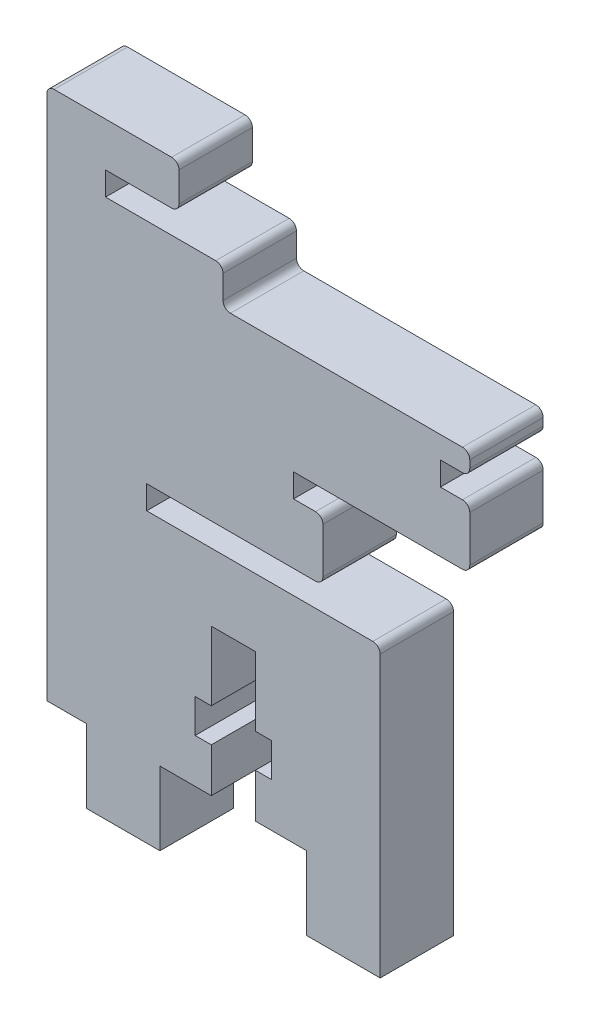
from build123d import *

# Parameters (mm, degrees)
BOSS_EXTRUDE1_DEPTH = 5
FILLET3_R           = 0.5


with BuildPart() as part:
    # Sketch1 → Boss-Extrude1 (new body)
    with BuildSketch(Plane.XY):
        Polygon((4.1, 19.6), (4.1, 21.2), (16.1, 21.2), (16.1, 25.3), (14.1, 25.3), (14.1, 26.9), (26.1, 26.9), (26.1, 31), (24.1, 31), (24.1, 32.6), (26.1, 32.6), (26.1, 34.1), (9.3, 34.1), (9.3, 36.7), (1.3, 36.7), (1.3, 38.3), (6.3, 38.3), (6.3, 41.3), (-2.7, 41.3), (-2.7, 5), (0, 5), (0, 0), (5, 0), (5, 5), (8.5, 5), (8.5, 8), (7.4, 8), (7.4, 10.3), (8.5, 10.3), (8.5, 15), (11.5, 15), (11.5, 10.3), (12.6, 10.3), (12.6, 8), (11.5, 8), (11.5, 5), (15, 5), (15, 0), (20, 0), (20, 5), (20, 19.6), align=None)
    extrude(amount=BOSS_EXTRUDE1_DEPTH)

    # Fillet3
    fillet3_edges = [part.edges().sort_by_distance(p)[0] for p in [
        (-2.7, 41.3, 2.5),
        (6.3, 41.3, 2.5),
        (6.3, 38.3, 2.5),
        (9.3, 36.7, 2.5),
        (9.3, 34.1, 2.5),
        (26.1, 34.1, 2.5),
        (26.1, 32.6, 2.5),
        (26.1, 31, 2.5),
        (26.1, 26.9, 2.5),
        (16.1, 25.3, 2.5),
        (16.1, 21.2, 2.5),
        (20, 19.6, 2.5),
    ]]
    fillet(fillet3_edges, radius=FILLET3_R)


solid = part.part
